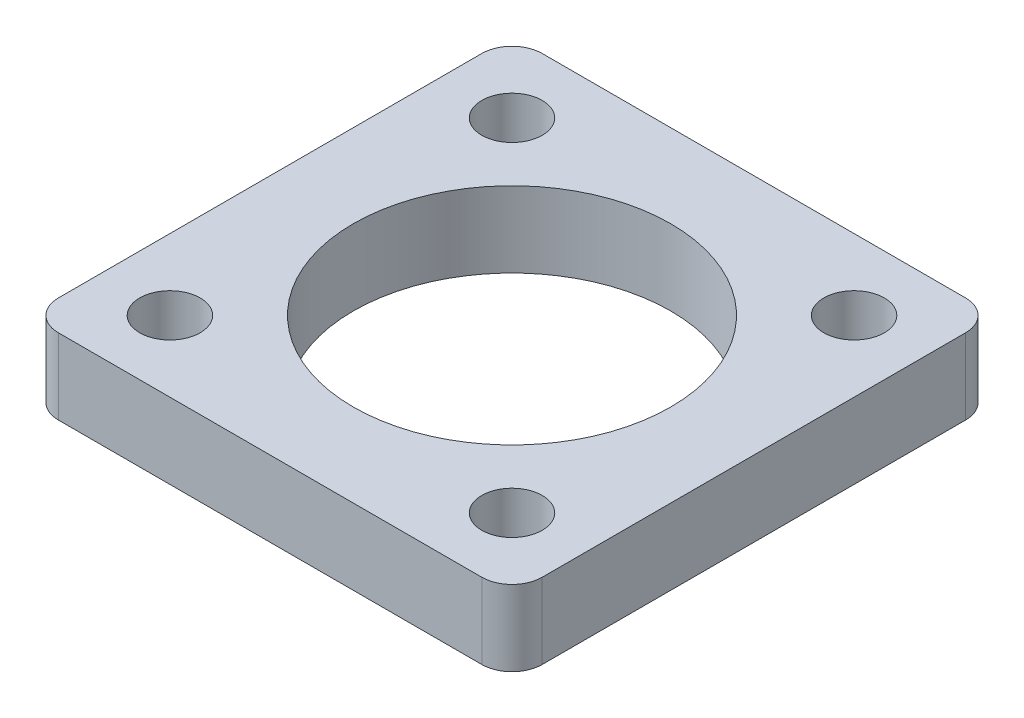
from build123d import *

# Parameters (mm, degrees)
SKETCH1_W           = 32
SKETCH1_H           = 32
SKETCH1_R           = 10.5
SKETCH1_R_2         = 2
BOSS_EXTRUDE1_DEPTH = 5
FILLET1_R           = 2


with BuildPart() as part:
    # Sketch1 → Boss-Extrude1 (new body)
    with BuildSketch(Plane(origin=(0, 0, 0), x_dir=(1, 0, 0), z_dir=(0, 1, 0))):
        Rectangle(SKETCH1_W, SKETCH1_H)
        with Locations(Location((0, 0, 0), (0, 0, 270))):
            Circle(SKETCH1_R, mode=Mode.SUBTRACT)
        with Locations(Location((-11.313708499, 11.313708499, 0), (0, 0, 270))):
            Circle(SKETCH1_R_2, mode=Mode.SUBTRACT)
        with Locations(Location((11.313708499, 11.313708499, 0), (0, 0, 270))):
            Circle(SKETCH1_R_2, mode=Mode.SUBTRACT)
        with Locations(Location((11.313708499, -11.313708499, 0), (0, 0, 270))):
            Circle(SKETCH1_R_2, mode=Mode.SUBTRACT)
        with Locations(Location((-11.313708499, -11.313708499, 0), (0, 0, 270))):
            Circle(SKETCH1_R_2, mode=Mode.SUBTRACT)
    extrude(amount=BOSS_EXTRUDE1_DEPTH)

    # Fillet1
    fillet1_edges = [part.edges().sort_by_distance(p)[0] for p in [
        (16, 2.5, 16),
        (-16, 2.5, 16),
        (-16, 2.5, -16),
        (16, 2.5, -16),
    ]]
    fillet(fillet1_edges, radius=FILLET1_R)


solid = part.part
